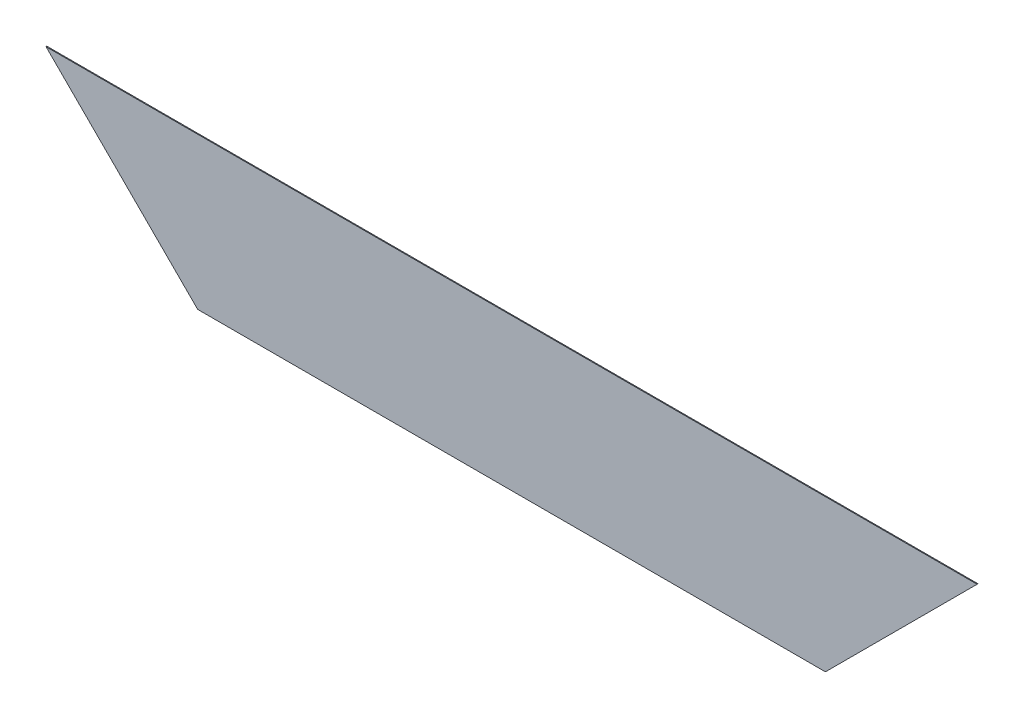
from build123d import *

# Parameters (mm, degrees)
BOSS_EXTRUDE1_DEPTH = 0.025


with BuildPart() as part:
    # Sketch1 → Boss-Extrude1 (new body)
    with BuildSketch(Plane.XY):
        Polygon((-13.35, 2.175), (-9, -2.175), (9, -2.175), (13.35, 2.175), align=None)
    extrude(amount=BOSS_EXTRUDE1_DEPTH)


solid = part.part
